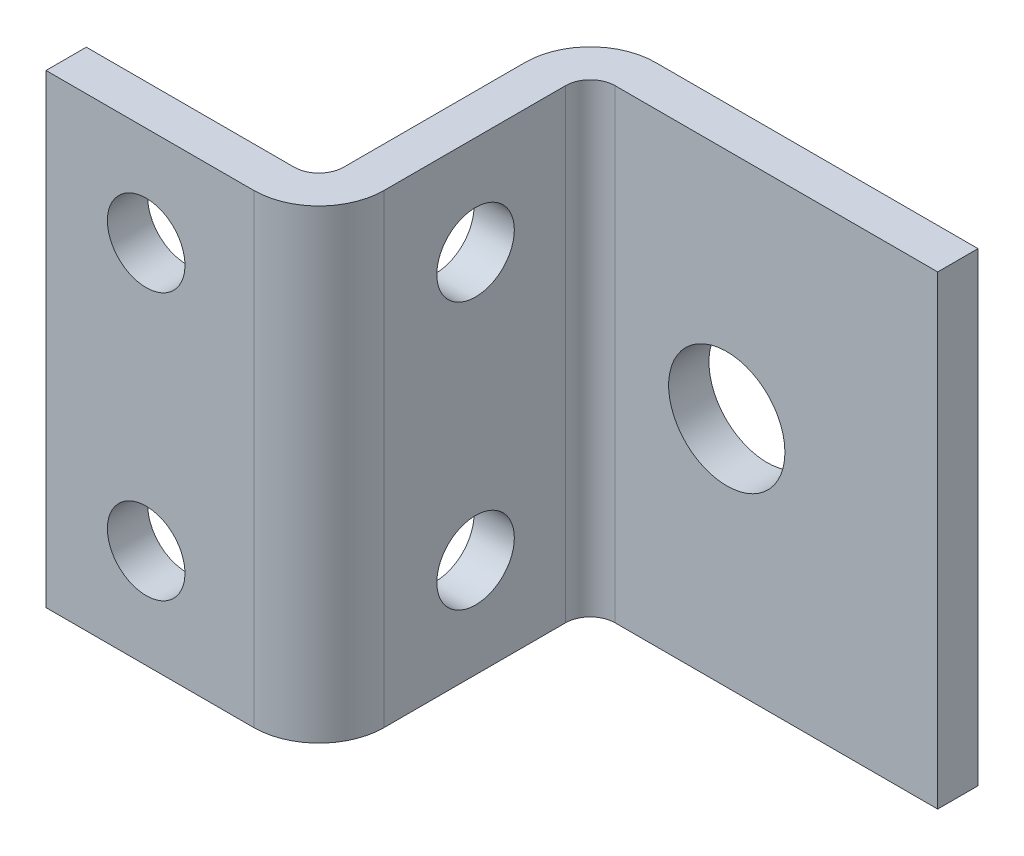
from build123d import *

# Parameters (mm, degrees)
EXTRUDE_THIN1_DEPTH = 19.05
SKETCH4_R           = 3.175
EXTRUDE3_DEPTH      = 63.672409033
SKETCH9_R           = 3.175
CUT_EXTRUDE3_DEPTH  = 43.706193146
SKETCH8_R           = 4.7625
CUT_EXTRUDE2_DEPTH  = 44.184668865


with BuildPart() as part:
    # Sketch1 → Extrude-Thin1 (new, symmetric)
    with BuildSketch(Plane(origin=(0, 0, 0), x_dir=(1, 0, 0), z_dir=(0, 1, 0))):
        with BuildLine():
            Line((-19.05, -22.225), (-2.032, -22.225))
            ThreePointArc((-2.032, -22.225), (-0.595159021, -21.629840979), (0, -20.193))
            Line((0, -20.193), (0, -5.334))
            ThreePointArc((0, -5.334), (1.562292429, -1.562292429), (5.334, 0))
            Line((5.334, 0), (31.75, 0))
            Line((31.75, 0), (31.75, -3.302))
            Line((31.75, -3.302), (5.334, -3.302))
            ThreePointArc((5.334, -3.302), (3.897159021, -3.897159021), (3.302, -5.334))
            Line((3.302, -5.334), (3.302, -20.193))
            ThreePointArc((3.302, -20.193), (1.739707571, -23.964707571), (-2.032, -25.527))
            Line((-2.032, -25.527), (-19.05, -25.527))
            Line((-19.05, -25.527), (-19.05, -22.225))
        make_face()
    extrude(amount=EXTRUDE_THIN1_DEPTH, both=True)

    # Sketch4 → Extrude3 (cut, through all)
    with BuildSketch(Plane(origin=(-22.225, 0, 25.527), x_dir=(-1, 0, 0), z_dir=(0, 0, -1))):
        with Locations((-11.3792, 10.922)):
            Circle(SKETCH4_R)
        with Locations((-11.3792, -10.922)):
            Circle(SKETCH4_R)
    extrude(amount=EXTRUDE3_DEPTH, mode=Mode.SUBTRACT)

    # Sketch9 → Cut-Extrude3 (cut, through all)
    with BuildSketch(Plane(origin=(3.302, 0, 0), x_dir=(0, 0, -1), z_dir=(1, 0, 0))):
        with Locations((-12.7, 10.922)):
            Circle(SKETCH9_R)
        with Locations((-12.7, -10.922)):
            Circle(SKETCH9_R)
    extrude(amount=-CUT_EXTRUDE3_DEPTH, mode=Mode.SUBTRACT)

    # Sketch8 → Cut-Extrude2 (cut, through all)
    with BuildSketch(Plane.XY.offset(3.302)):
        with Locations((14.478, 0)):
            Circle(SKETCH8_R)
        with Locations((-55.372, 0)):
            Circle(SKETCH8_R)
    extrude(amount=-CUT_EXTRUDE2_DEPTH, mode=Mode.SUBTRACT)


solid = part.part
